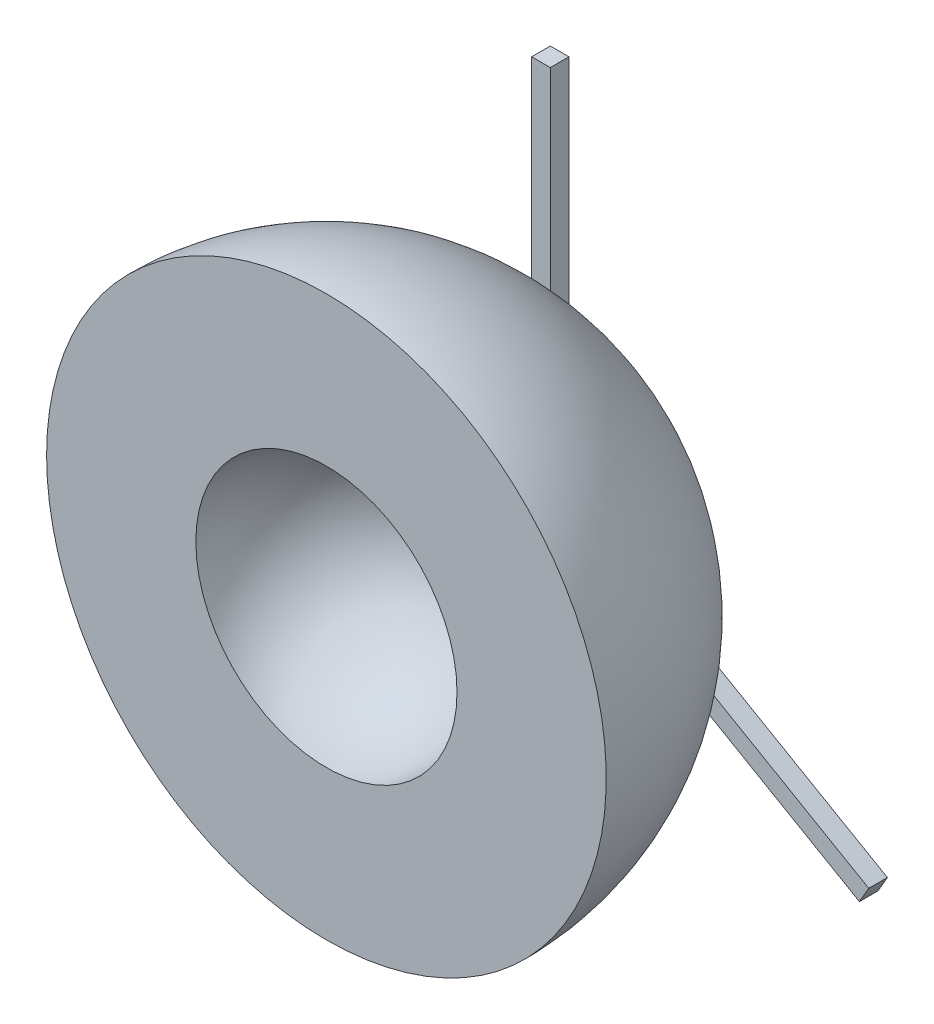
from build123d import *

# Parameters (mm, degrees)
REVOLVE_1_ANGLE = 180
SKETCH_2_W      = 10
SKETCH_2_H      = 10
EXTRUDE_1_DEPTH = 200
SKETCH_5_W      = 10
SKETCH_5_H      = 10
EXTRUDE_3_DEPTH = 200
SKETCH_6_W      = 10
SKETCH_6_H      = 10
EXTRUDE_4_DEPTH = 200


with BuildPart() as part:
    # ｽｹｯﾁ1 → 回転1 (revolve)
    with BuildSketch(Plane.XY):
        with BuildLine():
            Line((0, 70), (0, 150))
            ThreePointArc((0, 150), (-150, 0), (0, -150))
            Line((0, -150), (0, -70))
            ThreePointArc((0, -70), (-70, 0), (0, 70))
        make_face()
    revolve(axis=Axis((0, 150, 0), (0, -1, 0)), revolution_arc=REVOLVE_1_ANGLE)

    # ｽｹｯﾁ2 → ﾎﾞｽ - 押し出し1 (add)
    with BuildSketch(Plane(origin=(0, 0, 0), x_dir=(1, 0, 0), z_dir=(0, 1, 0))):
        with Locations((0, 120)):
            Rectangle(SKETCH_2_W, SKETCH_2_H)
    extrude(amount=EXTRUDE_1_DEPTH)

    # ｽｹｯﾁ5 → ﾎﾞｽ - 押し出し3 (add)
    with BuildSketch(Plane(origin=(0, 0, 0), x_dir=(0, 0, -1), z_dir=(0.8660254037844364, -0.5000000000000041, 0))):
        with Locations((120, 0)):
            Rectangle(SKETCH_5_W, SKETCH_5_H)
    extrude(amount=EXTRUDE_3_DEPTH)

    # ｽｹｯﾁ6 → ﾎﾞｽ - 押し出し4 (add)
    with BuildSketch(Plane(origin=(0, 0, 0), x_dir=(0, 0, -1), z_dir=(-0.8660254037844434, -0.49999999999999206, 0))):
        with Locations((120, 0)):
            Rectangle(SKETCH_6_W, SKETCH_6_H)
    extrude(amount=EXTRUDE_4_DEPTH)


solid = part.part
